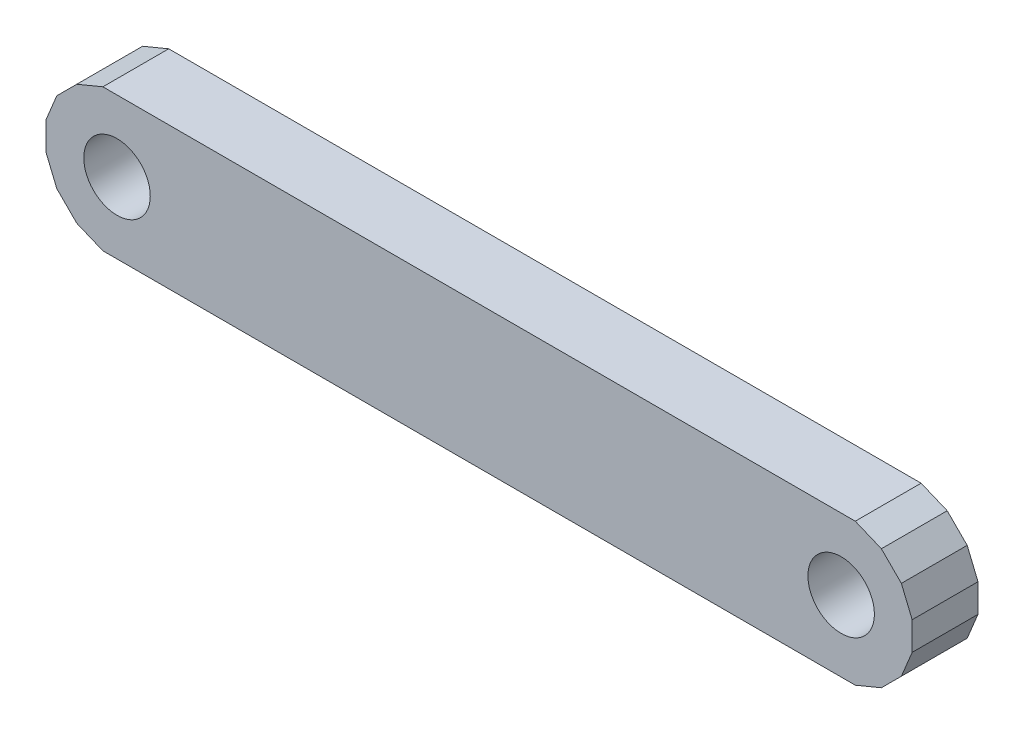
from build123d import *

# Parameters (mm, degrees)
PASSIVE_ARM_START = 8
PROFILE_1_R       = 5.05
PASSIVE_ARM_DEPTH = 10


with BuildPart() as part:
    # Profile_1 → Passive_arm (new body)
    with BuildSketch(Plane.XY.offset(PASSIVE_ARM_START)):
        Polygon((9.146165735, 6.111272563), (6.111272563, 9.146165735), (2.145993542, 10.788638084), (-112.145993542, 10.788638084), (-116.111272563, 9.146165735), (-119.146165735, 6.111272563), (-120.788638084, 2.145993542), (-120.788638084, -2.145993542), (-119.146165735, -6.111272563), (-116.111272563, -9.146165735), (-112.145993542, -10.788638084), (2.145993542, -10.788638084), (6.111272563, -9.146165735), (9.146165735, -6.111272563), (10.788638084, -2.145993542), (10.788638084, 2.145993542), align=None)
        Circle(PROFILE_1_R, mode=Mode.SUBTRACT)
        with Locations((-110, 0)):
            Circle(PROFILE_1_R, mode=Mode.SUBTRACT)
    extrude(amount=PASSIVE_ARM_DEPTH)


solid = part.part
